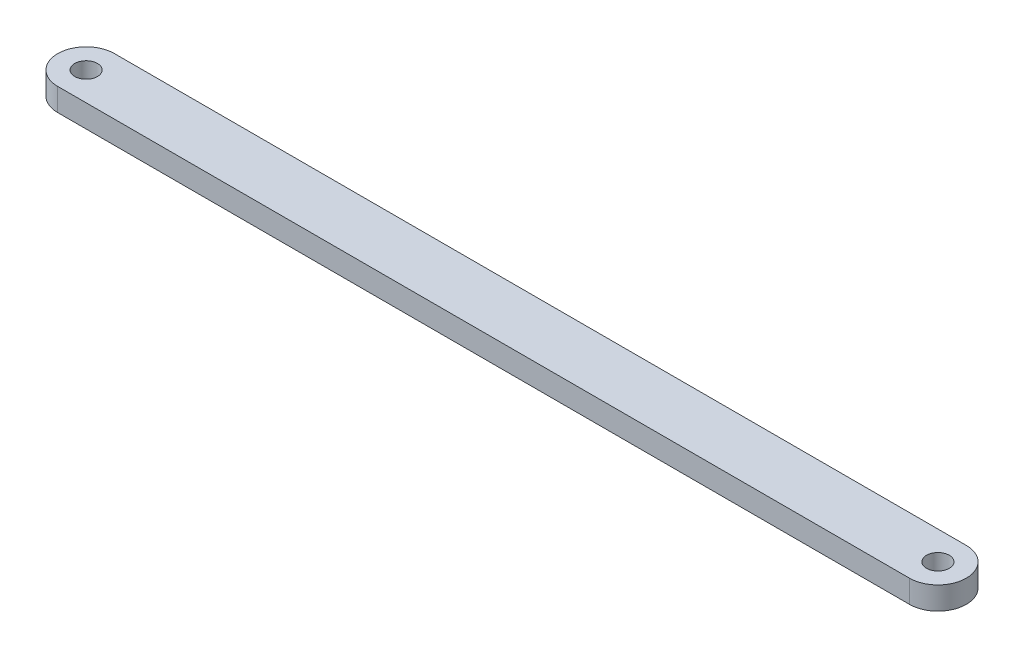
from build123d import *

# Parameters (mm, degrees)
SKETCH1_R           = 1
BOSS_EXTRUDE1_DEPTH = 2


with BuildPart() as part:
    # Sketch1 → Boss-Extrude1 (new body)
    with BuildSketch(Plane(origin=(0, 0, 0), x_dir=(1, 0, 0), z_dir=(0, 1, 0))):
        with BuildLine():
            Line((-10, 2.5), (65, 2.5))
            ThreePointArc((65, 2.5), (67.5, 0), (65, -2.5))
            Line((65, -2.5), (-10, -2.5))
            ThreePointArc((-10, -2.5), (-12.5, 0), (-10, 2.5))
        make_face()
        with Locations(Location((65, 0, 0), (0, 0, 270))):
            Circle(SKETCH1_R, mode=Mode.SUBTRACT)
        with Locations(Location((-10, 0, 0), (0, 0, 270))):
            Circle(SKETCH1_R, mode=Mode.SUBTRACT)
    extrude(amount=BOSS_EXTRUDE1_DEPTH)


solid = part.part
